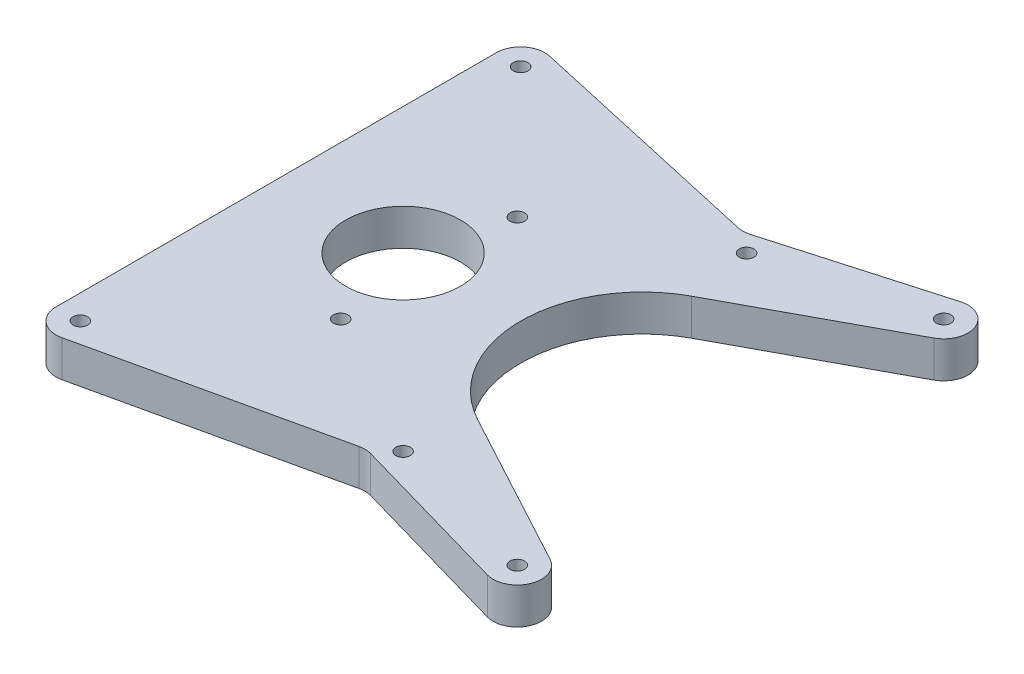
from build123d import *

# Parameters (mm, degrees)
SKETCH2_R           = 1.905
SKETCH2_R_2         = 15.012499947
BOSS_EXTRUDE1_DEPTH = 4.7625


with BuildPart() as part:
    # Sketch2 → Boss-Extrude1 (new, symmetric)
    with BuildSketch(Plane(origin=(0, 0, 0), x_dir=(1, 0, 0), z_dir=(0, 1, 0))):
        with BuildLine():
            Line((47.431459746, 27.946405755), (88.599086108, 50.143751648))
            ThreePointArc((88.599086108, 50.143751648), (91.466763895, 58.127150721), (83.838709673, 61.83808395))
            Line((83.838709673, 61.83808395), (41.161290327, 49.627981648))
            ThreePointArc((41.161290327, 49.627981648), (39.600064271, 49.38574116), (38.027358671, 49.536420772))
            Line((38.027358671, 49.536420772), (-25.448996349, 63.747156504))
            ThreePointArc((-25.448996349, 63.747156504), (-30.805729247, 62.50693539), (-33.186259621, 57.550544477))
            Line((-33.186259621, 57.550544477), (-33.186259621, -57.550544477))
            ThreePointArc((-33.186259621, -57.550544477), (-30.805729247, -62.50693539), (-25.448996349, -63.747156504))
            Line((-25.448996349, -63.747156504), (38.027358671, -49.536420772))
            ThreePointArc((38.027358671, -49.536420772), (39.600064271, -49.38574116), (41.161290327, -49.627981648))
            Line((41.161290327, -49.627981648), (83.838709673, -61.83808395))
            ThreePointArc((83.838709673, -61.83808395), (91.466763895, -58.127150721), (88.599086108, -50.143751648))
            Line((88.599086108, -50.143751648), (47.431459746, -27.946405755))
            ThreePointArc((47.431459746, -27.946405755), (30.75, 0), (47.431459746, 27.946405755))
        make_face()
        with Locations((6.766967201, -23.085378057)):
            Circle(SKETCH2_R, mode=Mode.SUBTRACT)
        with Locations((44.901280605, -44.901280605)):
            Circle(SKETCH2_R, mode=Mode.SUBTRACT)
        Circle(SKETCH2_R_2, mode=Mode.SUBTRACT)
        with Locations((6.766967201, 23.085378057)):
            Circle(SKETCH2_R, mode=Mode.SUBTRACT)
        with Locations((44.901280605, 44.901280605)):
            Circle(SKETCH2_R, mode=Mode.SUBTRACT)
        with Locations((85.585378057, 55.733032799)):
            Circle(SKETCH2_R, mode=Mode.SUBTRACT)
        with Locations((85.585378057, -55.733032799)):
            Circle(SKETCH2_R, mode=Mode.SUBTRACT)
        with Locations((-26.836259621, -57.550544477)):
            Circle(SKETCH2_R, mode=Mode.SUBTRACT)
        with Locations((-26.836259621, 57.550544477)):
            Circle(SKETCH2_R, mode=Mode.SUBTRACT)
    extrude(amount=BOSS_EXTRUDE1_DEPTH, both=True)


solid = part.part
